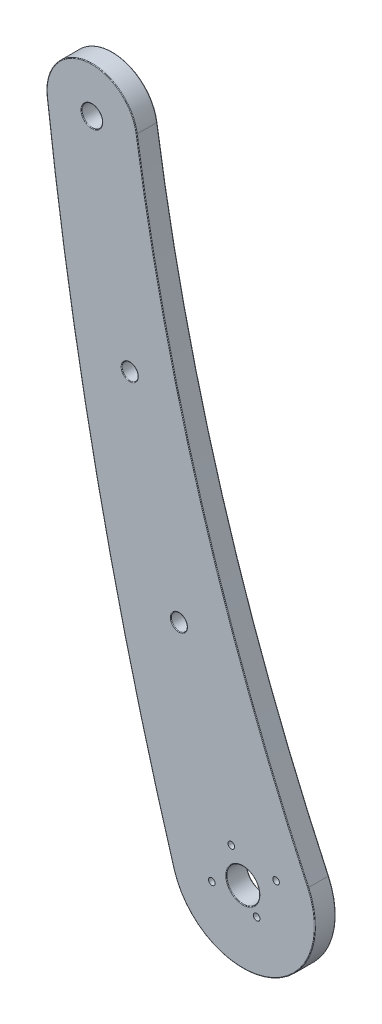
from build123d import *

# Parameters (mm, degrees)
SKETCH1_R              = 2.5
SKETCH1_R_2            = 4
BOSS_EXTRUDE1_DEPTH    = 5
M3_5_CLEARANCE_HOLE1_D = 3.9
FILLET1_R              = 0.15
SKETCH4_R              = 0.8
CUT_EXTRUDE1_DEPTH     = 223.627113526


with BuildPart() as part:
    # Sketch1 → Boss-Extrude1 (new body)
    with BuildSketch(Plane.XY):
        with BuildLine():
            ThreePointArc((-45.995855866, 202.607583819), (-30.15536968, 132.301119009), (-4.371970329, 65.002260812))
            ThreePointArc((-4.371970329, 65.002260812), (-13.948264924, 41.242456147), (-36.963658749, 52.49080638))
            ThreePointArc((-36.963658749, 52.49080638), (-55.641551414, 125.399850291), (-67.796802654, 199.675298628))
            ThreePointArc((-67.796802654, 199.675298628), (-58.339525021, 211.871309549), (-45.995855866, 202.607583819))
        make_face()
        with Locations((-56.873199998, 200.969479844)):
            Circle(SKETCH1_R, mode=Mode.SUBTRACT)
        with Locations((-20.22, 57.58)):
            Circle(SKETCH1_R_2, mode=Mode.SUBTRACT)
    extrude(amount=BOSS_EXTRUDE1_DEPTH)

    # M3.5 Clearance Hole1 (through all)
    with Locations(Plane.XY.offset(5)):
        with Locations((-47.687031561, 151.820580472), (-35.746420287, 105.108205027)):
            Hole(M3_5_CLEARANCE_HOLE1_D / 2)

    # Fillet1
    fillet1_edges = [part.edges().sort_by_distance(p)[0] for p in [
        (-59.373199998, 200.969479844, 0),
        (-59.373199998, 200.969479844, 5),
        (-13.948264924, 41.242456147, 5),
        (-24.22, 57.58, 0),
        (-24.22, 57.58, 5),
        (-30.15536968, 132.301119009, 5),
        (-33.796420287, 105.108205027, 5),
        (-33.796420287, 105.108205027, 0),
        (-45.737031561, 151.820580472, 5),
        (-45.737031561, 151.820580472, 0),
        (-58.339525021, 211.871309549, 5),
        (-30.15536968, 132.301119009, 0),
        (-13.948264924, 41.242456147, 0),
        (-55.641551414, 125.399850291, 0),
        (-58.339525021, 211.871309549, 0),
        (-55.641551414, 125.399850291, 5),
    ]]
    fillet(fillet1_edges, radius=FILLET1_R)

    # Sketch4 → Cut-Extrude1 (cut, through all)
    with BuildSketch(Plane.XY.offset(5)):
        with Locations((-27.74061462, 54.608769498)):
            Circle(SKETCH4_R)
        with Locations((-16.877401205, 52.580076742)):
            Circle(SKETCH4_R)
        with Locations((-23.020868887, 64.601216657)):
            Circle(SKETCH4_R)
        with Locations((-12.157655472, 62.572523901)):
            Circle(SKETCH4_R)
    extrude(amount=-CUT_EXTRUDE1_DEPTH, mode=Mode.SUBTRACT)


solid = part.part
